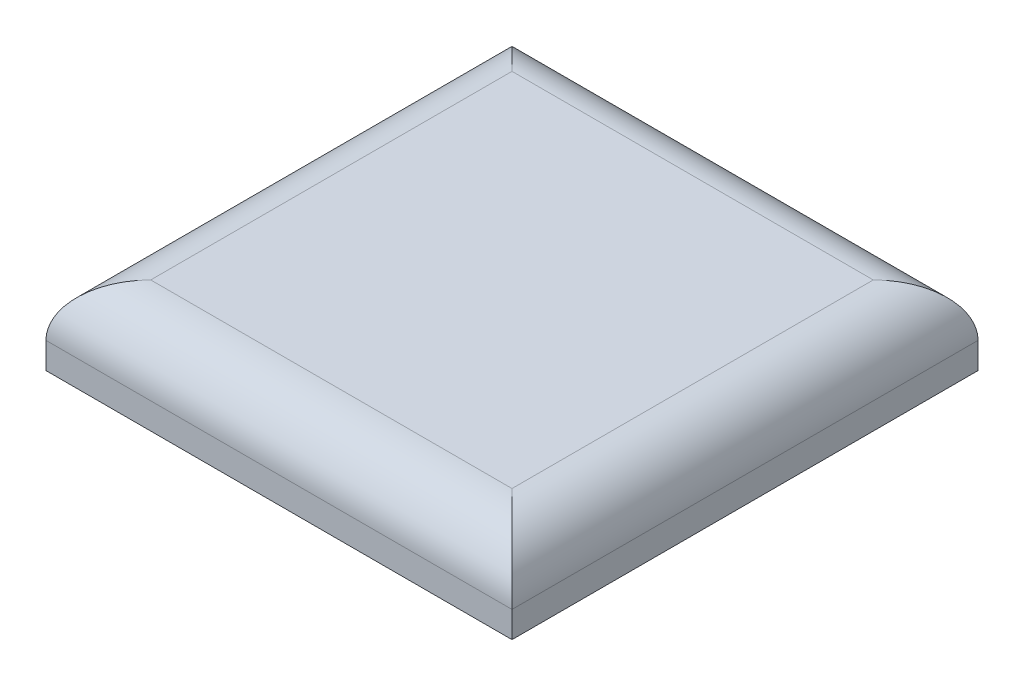
from build123d import *

# Parameters (mm, degrees)
SKETCH_1_W      = 17.8
SKETCH_1_H      = 17.8
EXTRUDE_1_DEPTH = 3
FILLET_1_R      = 2


with BuildPart() as part:
    # Эскиз1 → Бобышка-Вытянуть1 (new body)
    with BuildSketch(Plane(origin=(0, 0, 0), x_dir=(1, 0, 0), z_dir=(0, 1, 0))):
        Rectangle(SKETCH_1_W, SKETCH_1_H)
    extrude(amount=EXTRUDE_1_DEPTH)

    # Скругление1
    fillet_1_edges = [part.edges().sort_by_distance(p)[0] for p in [
        (-8.9, 3, 0),
        (0, 3, 8.9),
        (8.9, 3, 0),
        (0, 3, -8.9),
    ]]
    fillet(fillet_1_edges, radius=FILLET_1_R)


solid = part.part
